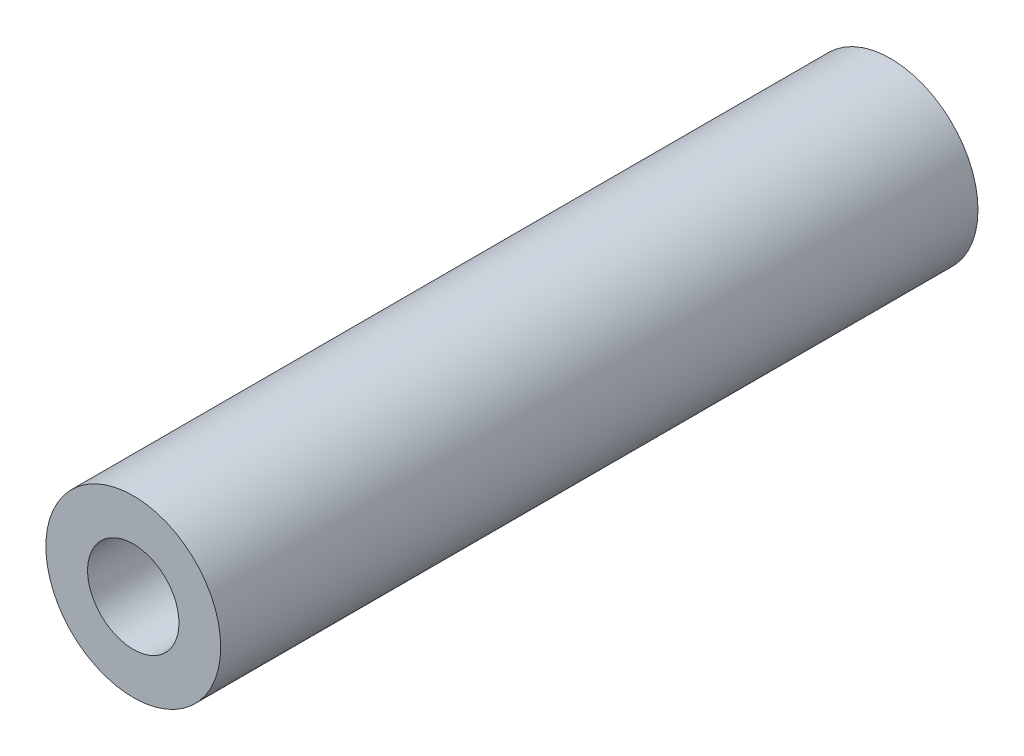
from build123d import *

# Parameters (mm, degrees)
SKETCH1_R           = 4.7625
SKETCH1_R_2         = 2.4892
BOSS_EXTRUDE1_DEPTH = 20.6248


with BuildPart() as part:
    # Sketch1 → Boss-Extrude1 (new, symmetric)
    with BuildSketch(Plane.XY):
        Circle(SKETCH1_R)
        Circle(SKETCH1_R_2, mode=Mode.SUBTRACT)
    extrude(amount=BOSS_EXTRUDE1_DEPTH, both=True)


solid = part.part
